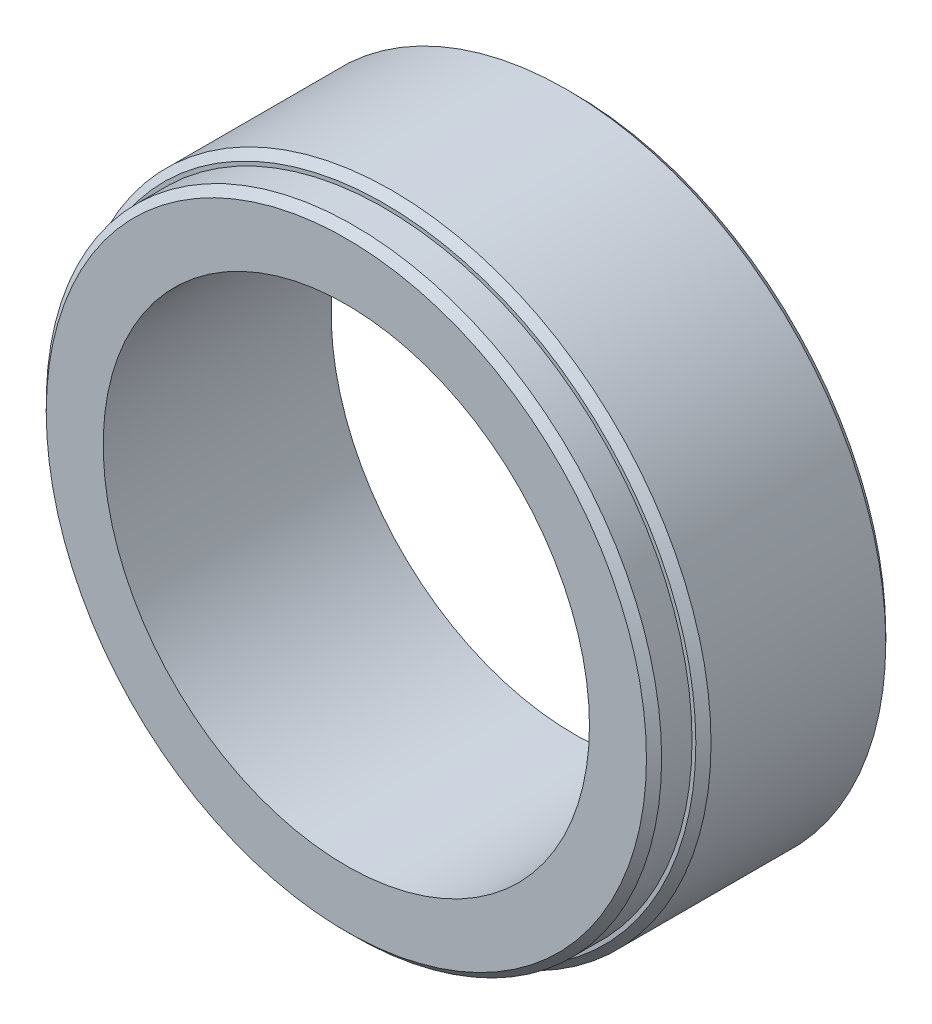
from build123d import *

# Parameters (mm, degrees)
SKETCH1_R           = 42
SKETCH1_R_2         = 32
BOSS_EXTRUDE1_DEPTH = 25
SKETCH2_R           = 40.5
SKETCH2_R_2         = 32
BOSS_EXTRUDE2_DEPTH = 5
CHAMFER1_SIZE       = 1


with BuildPart() as part:
    # Sketch1 → Boss-Extrude1 (new body)
    with BuildSketch(Plane.XY):
        Circle(SKETCH1_R)
        Circle(SKETCH1_R_2, mode=Mode.SUBTRACT)
    extrude(amount=BOSS_EXTRUDE1_DEPTH)

    # Sketch2 → Boss-Extrude2 (add)
    with BuildSketch(Plane.XY.offset(25)):
        Circle(SKETCH2_R)
        Circle(SKETCH2_R_2, mode=Mode.SUBTRACT)
    extrude(amount=BOSS_EXTRUDE2_DEPTH)

    # Chamfer1
    chamfer1_edges = [part.edges().sort_by_distance(p)[0] for p in [
        (-40.5, 0, 30),
        (-42, 0, 0),
        (-42, 0, 25),
    ]]
    chamfer(chamfer1_edges, length=CHAMFER1_SIZE)


solid = part.part
